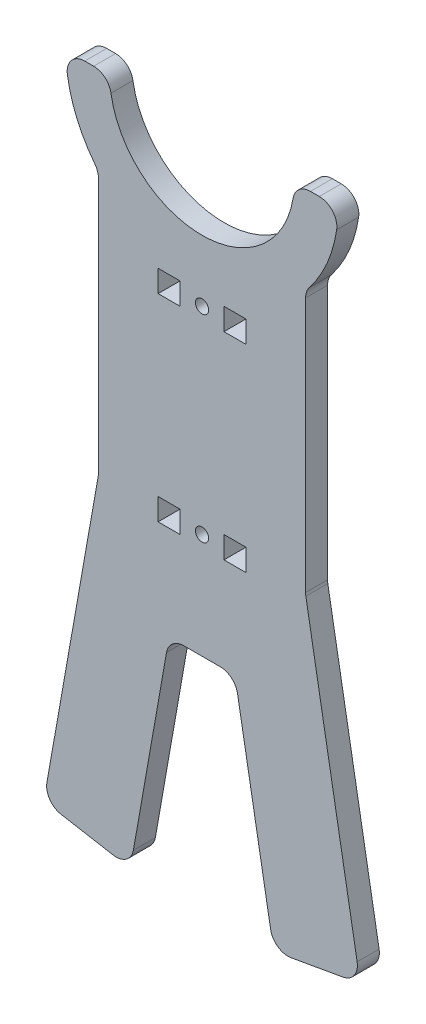
from build123d import *

# Parameters (mm, degrees)
SKETCH1_R           = 1.5
SKETCH1_W           = 5
SKETCH1_H           = 5
BOSS_EXTRUDE1_DEPTH = 5
FILLET1_R           = 4


with BuildPart() as part:
    # Sketch1 → Boss-Extrude1 (new body)
    with BuildSketch(Plane.XY):
        with BuildLine():
            Line((-21, 80), (-31, 80))
            ThreePointArc((-31, 80), (-29.085023859, 69.273332897), (-23.576684701, 59.871911702))
            Line((-23.576684701, 59.871911702), (-23.576684701, 0))
            Line((-23.576684701, 0), (-36.012504096, -70.527036447))
            Line((-36.012504096, -70.527036447), (-16.316349035, -74))
            Line((-16.316349035, -74), (-7.5, -24))
            Line((-7.5, -24), (7.5, -24))
            Line((7.5, -24), (16.316349035, -74))
            Line((16.316349035, -74), (36.012504096, -70.527036447))
            Line((36.012504096, -70.527036447), (23.576684701, 0))
            Line((23.576684701, 0), (23.576684701, 59.871911702))
            ThreePointArc((23.576684701, 59.871911702), (29.085023859, 69.273332897), (31, 80))
            Line((31, 80), (21, 80))
            ThreePointArc((21, 80), (0, 59), (-21, 80))
        make_face()
        Circle(SKETCH1_R, mode=Mode.SUBTRACT)
        with Locations((0, 45)):
            Circle(SKETCH1_R, mode=Mode.SUBTRACT)
        with Locations((-7.5, 0)):
            Rectangle(SKETCH1_W, SKETCH1_H, mode=Mode.SUBTRACT)
        with Locations((7.5, 0)):
            Rectangle(SKETCH1_W, SKETCH1_H, mode=Mode.SUBTRACT)
        with Locations((-7.5, 45)):
            Rectangle(SKETCH1_W, SKETCH1_H, mode=Mode.SUBTRACT)
        with Locations((7.5, 45)):
            Rectangle(SKETCH1_W, SKETCH1_H, mode=Mode.SUBTRACT)
    extrude(amount=BOSS_EXTRUDE1_DEPTH)

    # Fillet1
    fillet1_edges = [part.edges().sort_by_distance(p)[0] for p in [
        (21, 80, 2.5),
        (31, 80, 2.5),
        (23.576684701, 59.871911702, 2.5),
        (23.576684701, 0, 2.5),
        (36.012504096, -70.527036447, 2.5),
        (16.316349035, -74, 2.5),
        (7.5, -24, 2.5),
        (-7.5, -24, 2.5),
        (-16.316349035, -74, 2.5),
        (-36.012504096, -70.527036447, 2.5),
        (-23.576684701, 0, 2.5),
        (-23.576684701, 59.871911702, 2.5),
        (-31, 80, 2.5),
        (-21, 80, 2.5),
    ]]
    fillet(fillet1_edges, radius=FILLET1_R)


solid = part.part
